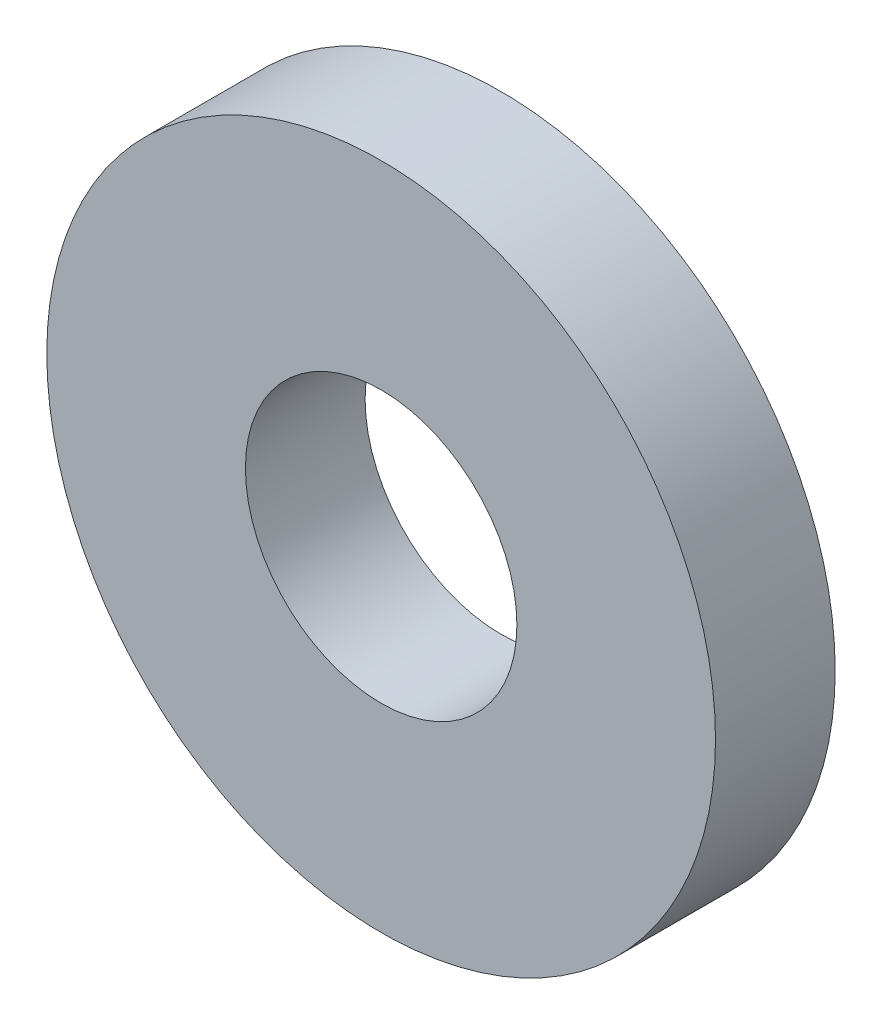
from build123d import *

# Parameters (mm, degrees)
SKETCH2_R           = 6.35
SKETCH2_R_2         = 2.5781
BOSS_EXTRUDE1_DEPTH = 1.13665


with BuildPart() as part:
    # Sketch2 → Boss-Extrude1 (new, symmetric)
    with BuildSketch(Plane.XY):
        Circle(SKETCH2_R)
        Circle(SKETCH2_R_2, mode=Mode.SUBTRACT)
    extrude(amount=BOSS_EXTRUDE1_DEPTH, both=True)


solid = part.part
